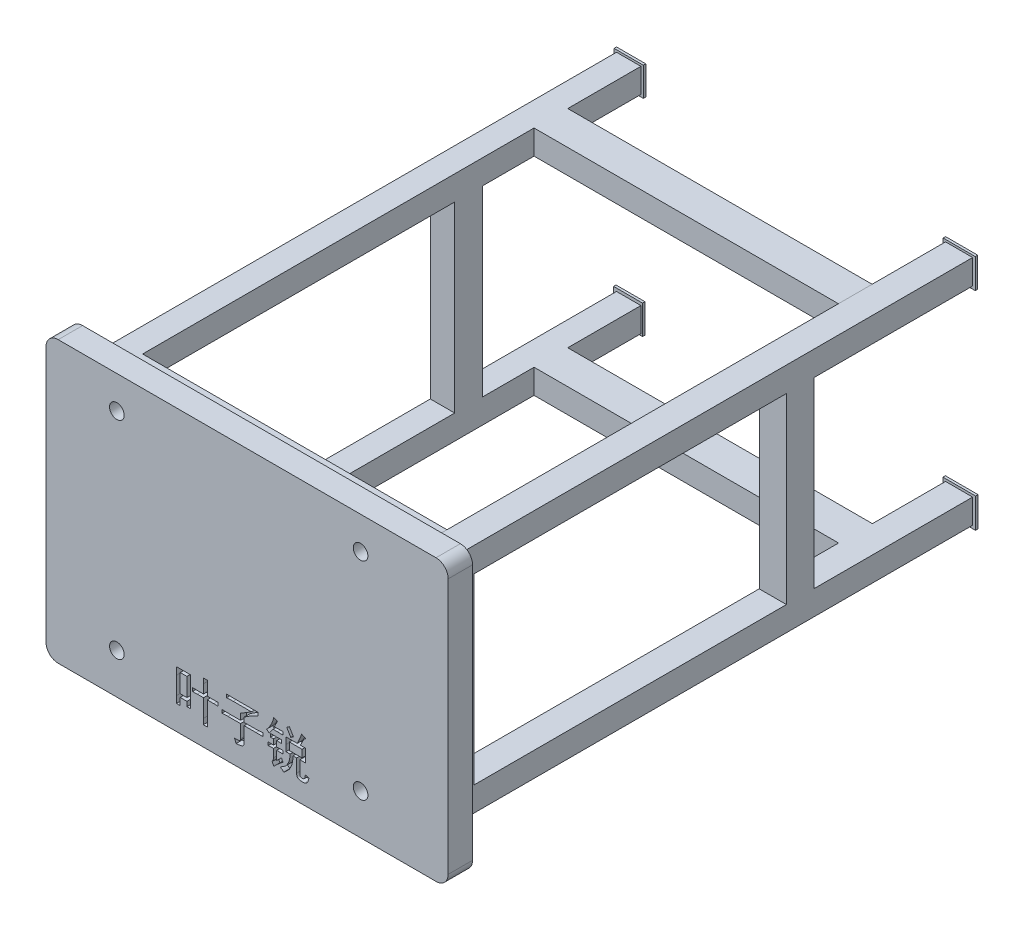
from build123d import *

# Parameters (mm, degrees)
EXTRUDE_1_DEPTH      = 20
SKETCH_3_W           = 250
SKETCH_3_H           = 20
EXTRUDE_2_DEPTH      = 20
SKETCH_4_W           = 250
SKETCH_4_H           = 20
EXTRUDE_3_DEPTH      = 20
SKETCH_2_3_R         = 6
CUT_EXTRUDE_2_DEPTH  = 40
SKETCH_5_W           = 22.217618234
SKETCH_5_H           = 20.249754408
SKETCH_5_H_2         = 20
SKETCH_5_W_2         = 20
EXTRUDE_4_DEPTH      = 430
SKETCH_6_W           = 22.217618234
SKETCH_6_H           = 150
SKETCH_6_W_2         = 20
EXTRUDE_6_DEPTH      = 20
SKETCH_6_5_W         = 22.217618234
SKETCH_6_5_H         = 150
SKETCH_6_5_W_2       = 20
EXTRUDE_13_DEPTH     = 300
SKETCH_10_W          = 256.372974203
SKETCH_10_H          = 150
CUT_EXTRUDE_9_DEPTH  = 400
SKETCH_4_4_W         = 250
SKETCH_4_4_H         = 20
EXTRUDE_14_DEPTH     = 370
SKETCH_3_4_W         = 250
SKETCH_3_4_H         = 20
EXTRUDE_15_DEPTH     = 370
SKETCH_11_W          = 249.850317038
SKETCH_11_H          = 321.198114599
CUT_EXTRUDE_10_DEPTH = 400
SKETCH_2_R           = 6
CUT_EXTRUDE_12_DEPTH = 200
SKETCH_13_W          = 23.789471045
SKETCH_13_H          = 23.789471045
EXTRUDE_17_DEPTH     = 2
SKETCH_14_W          = 26.40849538
SKETCH_14_H          = 24.2259751
EXTRUDE_18_DEPTH     = 2
SKETCH_15_W          = 26.844999436
SKETCH_15_H          = 24.444227128
EXTRUDE_19_DEPTH     = 2
SKETCH_17_W          = 24.007723073
SKETCH_17_H          = 23.571219016
EXTRUDE_21_DEPTH     = 2
SKETCH_20_W          = 5.555555556
SKETCH_20_H          = 15.058479533
SKETCH_20_W_2        = 10.380116959
SKETCH_20_H_2        = 6.140350877
CUT_EXTRUDE_13_DEPTH = 5


with BuildPart() as part:
    # 草图1 → 凸台-拉伸1 (new body)
    with BuildSketch(Plane.XY):
        with BuildLine():
            Line((-38.138232369, 236.708963796), (-38.138232369, 26.708963796))
            ThreePointArc((-38.138232369, 26.708963796), (-35.209300181, 19.637895984), (-28.138232369, 16.708963796))
            Line((-28.138232369, 16.708963796), (281.861767631, 16.708963796))
            ThreePointArc((281.861767631, 16.708963796), (288.932835443, 19.637895984), (291.861767631, 26.708963796))
            Line((291.861767631, 26.708963796), (291.861767631, 236.708963796))
            ThreePointArc((291.861767631, 236.708963796), (288.932835443, 243.780031608), (281.861767631, 246.708963796))
            Line((281.861767631, 246.708963796), (-28.138232369, 246.708963796))
            ThreePointArc((-28.138232369, 246.708963796), (-35.209300181, 243.780031608), (-38.138232369, 236.708963796))
        make_face()
    extrude(amount=EXTRUDE_1_DEPTH)

    # 草图3 → 凸台-拉伸2 (add)
    with BuildSketch(Plane(origin=(0, 0, 0), x_dir=(-1, 0, 0), z_dir=(0, 0, -1))):
        with Locations((-125, 220)):
            Rectangle(SKETCH_3_W, SKETCH_3_H)
    extrude(amount=EXTRUDE_2_DEPTH)

    # 草图4 → 凸台-拉伸3 (add)
    with BuildSketch(Plane(origin=(0, 0, 0), x_dir=(-1, 0, 0), z_dir=(0, 0, -1))):
        with Locations((-125, 50)):
            Rectangle(SKETCH_4_W, SKETCH_4_H)
    extrude(amount=EXTRUDE_3_DEPTH)

    # 草图2<3> → 切除-拉伸2 (cut)
    with BuildSketch(Plane.XY.offset(20)):
        with Locations((20, 220)):
            Circle(SKETCH_2_3_R)
        with Locations((20, 50)):
            Circle(SKETCH_2_3_R)
        with Locations((220, 50)):
            Circle(SKETCH_2_3_R)
        with Locations((220, 220)):
            Circle(SKETCH_2_3_R)
    extrude(amount=-CUT_EXTRUDE_2_DEPTH, mode=Mode.SUBTRACT)

    # 草图5 → 凸台-拉伸4 (add)
    with BuildSketch(Plane(origin=(0, 0, 0), x_dir=(-1, 0, 0), z_dir=(0, 0, -1))):
        with Locations((-261.108809117, 220.124877204)):
            Rectangle(SKETCH_5_W, SKETCH_5_H)
        with Locations((-261.108809117, 50)):
            Rectangle(SKETCH_5_W, SKETCH_5_H_2)
        with Locations((10, 220)):
            Rectangle(SKETCH_5_W_2, SKETCH_5_H_2)
        with Locations((10, 50)):
            Rectangle(SKETCH_5_W_2, SKETCH_5_H_2)
    extrude(amount=EXTRUDE_4_DEPTH)

    # 草图6 → 凸台-拉伸6 (add)
    with BuildSketch(Plane(origin=(0, 0, 0), x_dir=(-1, 0, 0), z_dir=(0, 0, -1))):
        with Locations((-261.108809117, 135)):
            Rectangle(SKETCH_6_W, SKETCH_6_H)
        with Locations((10, 135)):
            Rectangle(SKETCH_6_W_2, SKETCH_6_H)
    extrude(amount=EXTRUDE_6_DEPTH)

    # 草图6<5> → 凸台-拉伸13 (add)
    with BuildSketch(Plane(origin=(0, 0, 0), x_dir=(-1, 0, 0), z_dir=(0, 0, -1))):
        with Locations((-261.108809117, 135)):
            Rectangle(SKETCH_6_5_W, SKETCH_6_5_H)
        with Locations((10, 135)):
            Rectangle(SKETCH_6_5_W_2, SKETCH_6_5_H)
    extrude(amount=EXTRUDE_13_DEPTH)

    # 草图10 → 切除-拉伸9 (cut)
    with BuildSketch(Plane(origin=(272.217618234, 0, 0), x_dir=(0, 0, -1), z_dir=(1, 0, 0))):
        with Locations((149.029257436, 135)):
            Rectangle(SKETCH_10_W, SKETCH_10_H)
    extrude(amount=-CUT_EXTRUDE_9_DEPTH, mode=Mode.SUBTRACT)

    # 草图4<4> → 凸台-拉伸14 (add)
    with BuildSketch(Plane(origin=(0, 0, 0), x_dir=(-1, 0, 0), z_dir=(0, 0, -1))):
        with Locations((-125, 50)):
            Rectangle(SKETCH_4_4_W, SKETCH_4_4_H)
    extrude(amount=EXTRUDE_14_DEPTH)

    # 草图3<4> → 凸台-拉伸15 (add)
    with BuildSketch(Plane(origin=(0, 0, 0), x_dir=(-1, 0, 0), z_dir=(0, 0, -1))):
        with Locations((-125, 220)):
            Rectangle(SKETCH_3_4_W, SKETCH_3_4_H)
    extrude(amount=EXTRUDE_15_DEPTH)

    # 草图11 → 切除-拉伸10 (cut)
    with BuildSketch(Plane(origin=(0, 40, 0), x_dir=(-1, 0, 0), z_dir=(0, -1, 0))):
        with Locations((-124.925158519, 181.740579508)):
            Rectangle(SKETCH_11_W, SKETCH_11_H)
    extrude(amount=-CUT_EXTRUDE_10_DEPTH, mode=Mode.SUBTRACT)

    # 草图2 → 切除-拉伸12 (cut)
    with BuildSketch(Plane.XY.offset(20)):
        with Locations((20, 220)):
            Circle(SKETCH_2_R)
        with Locations((20, 50)):
            Circle(SKETCH_2_R)
        with Locations((220, 50)):
            Circle(SKETCH_2_R)
        with Locations((220, 220)):
            Circle(SKETCH_2_R)
    extrude(amount=-CUT_EXTRUDE_12_DEPTH, mode=Mode.SUBTRACT)

    # 草图13 → 凸台-拉伸17 (add)
    with BuildSketch(Plane(origin=(0, 0, -430), x_dir=(-1, 0, 0), z_dir=(0, 0, -1))):
        with Locations((10.527883953, 50.519209405)):
            Rectangle(SKETCH_13_W, SKETCH_13_H)
    extrude(amount=EXTRUDE_17_DEPTH)

    # 草图14 → 凸台-拉伸18 (add)
    with BuildSketch(Plane(origin=(0, 0, -430), x_dir=(-1, 0, 0), z_dir=(0, 0, -1))):
        with Locations((-261.195890824, 219.882783081)):
            Rectangle(SKETCH_14_W, SKETCH_14_H)
    extrude(amount=EXTRUDE_18_DEPTH)

    # 草图15 → 凸台-拉伸19 (add)
    with BuildSketch(Plane(origin=(0, 0, -430), x_dir=(-1, 0, 0), z_dir=(0, 0, -1))):
        with Locations((-261.195890824, 49.755327307)):
            Rectangle(SKETCH_15_W, SKETCH_15_H)
    extrude(amount=EXTRUDE_19_DEPTH)

    # 草图17 → 凸台-拉伸21 (add)
    with BuildSketch(Plane(origin=(0, 0, -430), x_dir=(-1, 0, 0), z_dir=(0, 0, -1))):
        with Locations((9.982253884, 219.991909095)):
            Rectangle(SKETCH_17_W, SKETCH_17_H)
    extrude(amount=EXTRUDE_21_DEPTH)

    # 草图20 → 切除-拉伸13 (cut)
    # profile 1 of 7: a face of its own
    with BuildSketch(Plane.XY.offset(20)):
        with BuildLine():
            add(Edge.make_bspline(
                [(80.585150008, 62.833981145), (80.543192801, 61.823365888), (80.460275153, 59.82614427), (80.446001976, 57.827257852), (80.438951177, 56.839829098)],
                knots=[0, 0, 0, 0, 1.012021148, 2, 2, 2, 2], degree=3))
            Line((80.438951177, 56.839829098), (80.438951177, 44.412928513))
            add(Edge.make_bspline(
                [(80.438951177, 44.412928513), (80.44130177, 43.911144546), (80.445927192, 42.923750114), (80.474265108, 41.470718415), (80.514010208, 40.071545237), (80.561745727, 39.158722588), (80.585150008, 38.711174127)],
                knots=[0, 0, 0, 0, 1.055588755, 2.077153766, 3.057246363, 4, 4, 4, 4], degree=3))
            Line((80.585150008, 38.711174127), (77.514974569, 38.711174127))
            Line((77.514974569, 38.711174127), (77.514974569, 42.512343718))
            Line((77.514974569, 42.512343718), (71.959419013, 42.512343718))
            Line((71.959419013, 42.512343718), (71.959419013, 36.664390502))
            Line((71.959419013, 36.664390502), (68.889243575, 36.664390502))
            add(Edge.make_bspline(
                [(68.889243575, 36.664390502), (68.931200297, 37.626265585), (69.014065324, 39.525980394), (69.028377069, 41.427442544), (69.035442405, 42.366144888)],
                knots=[0, 0, 0, 0, 1.012652087, 2, 2, 2, 2], degree=3))
            Line((69.035442405, 42.366144888), (69.035442405, 56.839829098))
            add(Edge.make_bspline(
                [(69.035442405, 56.839829098), (69.036300893, 57.02032948), (69.038112458, 57.401217807), (69.022872119, 58.002177545), (69.014684889, 58.662849736), (68.997909823, 59.3830264), (68.974158069, 60.160839191), (68.956394084, 60.998553174), (68.919691525, 61.895352555), (68.899607329, 62.514494427), (68.889243575, 62.833981145)],
                knots=[0, 0, 0, 0, 0.722422131, 1.524440851, 2.405914273, 3.366980104, 4.40766924, 5.520574543, 6.720578373, 8, 8, 8, 8], degree=3))
            Line((68.889243575, 62.833981145), (80.585150008, 62.833981145))
        make_face()
        with Locations((74.737196791, 52.673162432)):
            Rectangle(SKETCH_20_W, SKETCH_20_H, mode=Mode.SUBTRACT)
    # profile 2 of 7: a face of its own
    with BuildSketch(Plane.XY.offset(20)):
        with BuildLine():
            Line((91.111465797, 54.500647812), (91.111465797, 61.810589332))
            add(Edge.make_bspline(
                [(91.111465797, 61.810589332), (91.11256123, 62.045238451), (91.114667972, 62.496516838), (91.100238096, 63.144428858), (91.091408531, 63.738314949), (91.076270482, 64.276300025), (91.051652908, 64.761606629), (91.035301073, 65.191792836), (91.000038538, 65.566870533), (90.976243253, 65.797686035), (90.965266967, 65.904156584)],
                knots=[0, 0, 0, 0, 1.374144617, 2.642761962, 3.795123306, 4.852633186, 5.794343395, 6.641027226, 7.373133195, 8, 8, 8, 8], degree=3))
            Line((90.965266967, 65.904156584), (94.474038896, 65.904156584))
            add(Edge.make_bspline(
                [(94.474038896, 65.904156584), (94.449268543, 65.797925973), (94.395850826, 65.568837733), (94.338913544, 65.192328301), (94.291148911, 64.762384842), (94.254702018, 64.276405942), (94.223432691, 63.73844408), (94.193002302, 63.144745135), (94.186604048, 62.496464473), (94.183338981, 62.04522273), (94.181641236, 61.810589332)],
                knots=[0, 0, 0, 0, 0.636468155, 1.372555132, 2.220663323, 3.161164639, 4.216548803, 5.366059947, 6.63042302, 8, 8, 8, 8], degree=3))
            Line((94.181641236, 61.810589332), (94.181641236, 54.500647812))
            Line((94.181641236, 54.500647812), (99.44479913, 54.500647812))
            add(Edge.make_bspline(
                [(99.44479913, 54.500647812), (99.665009697, 54.49952943), (100.0856083, 54.497393339), (100.684785068, 54.511790437), (101.220922834, 54.520453246), (101.692163115, 54.535526708), (102.098028795, 54.559785709), (102.43997446, 54.576179987), (102.717689963, 54.610366646), (102.881427118, 54.63568928), (102.95357106, 54.646846642)],
                knots=[0, 0, 0, 0, 1.503568052, 2.871790535, 4.092147988, 5.165001825, 6.090640109, 6.868636212, 7.50151177, 8, 8, 8, 8], degree=3))
            Line((102.95357106, 54.646846642), (102.95357106, 51.722870034))
            add(Edge.make_bspline(
                [(102.95357106, 51.722870034), (102.872387599, 51.733952337), (102.692266796, 51.758540515), (102.398343763, 51.7924667), (102.052911396, 51.809859979), (101.657860381, 51.833915113), (101.21190129, 51.849050667), (100.715467366, 51.857890726), (100.170445706, 51.872286544), (99.789550361, 51.870171428), (99.590997961, 51.869068864)],
                knots=[0, 0, 0, 0, 0.583846774, 1.295374051, 2.107220792, 3.047450011, 4.115573545, 5.286167145, 6.585338371, 8, 8, 8, 8], degree=3))
            Line((99.590997961, 51.869068864), (94.181641236, 51.869068864))
            Line((94.181641236, 51.869068864), (94.181641236, 37.395384654))
            add(Edge.make_bspline(
                [(94.181641236, 37.395384654), (94.18054857, 37.13546742), (94.178439004, 36.633655823), (94.193130099, 35.90452128), (94.20163091, 35.225805557), (94.217162083, 34.597607665), (94.241683539, 34.02021085), (94.25828067, 33.492698371), (94.294029828, 33.014725659), (94.316980144, 32.713405671), (94.327840066, 32.57082325)],
                knots=[0, 0, 0, 0, 1.291974514, 2.49436248, 3.624982585, 4.666087828, 5.617801518, 6.497794058, 7.289167102, 8, 8, 8, 8], degree=3))
            Line((94.327840066, 32.57082325), (90.965266967, 32.57082325))
            add(Edge.make_bspline(
                [(90.965266967, 32.57082325), (90.976133112, 32.711600314), (90.999112195, 33.009307315), (91.034660883, 33.480066291), (91.051490436, 33.99854912), (91.075737838, 34.561512838), (91.091402356, 35.168045904), (91.100059563, 35.81968901), (91.114641828, 36.518138934), (91.112547959, 37.0000979), (91.111465797, 37.249185823)],
                knots=[0, 0, 0, 0, 0.723794872, 1.530638549, 2.419609744, 3.382538411, 4.419144022, 5.529548865, 6.72321175, 8, 8, 8, 8], degree=3))
            Line((91.111465797, 37.249185823), (91.111465797, 51.869068864))
            Line((91.111465797, 51.869068864), (85.994506733, 51.869068864))
            add(Edge.make_bspline(
                [(85.994506733, 51.869068864), (85.75985708, 51.870198822), (85.312187151, 51.872354582), (84.669693859, 51.857737078), (84.088432285, 51.849284491), (83.564890552, 51.833750506), (83.1012386, 51.809555408), (82.696257174, 51.793247163), (82.351877417, 51.757958394), (82.142773364, 51.733881674), (82.047138312, 51.722870034)],
                knots=[0, 0, 0, 0, 1.424841977, 2.718345834, 3.902263659, 4.954968297, 5.89857508, 6.721767569, 7.415392363, 8, 8, 8, 8], degree=3))
            Line((82.047138312, 51.722870034), (82.047138312, 54.646846642))
            add(Edge.make_bspline(
                [(82.047138312, 54.646846642), (82.140963143, 54.635782275), (82.348222112, 54.611341097), (82.685476897, 54.577238946), (83.079560377, 54.559911843), (83.526984274, 54.53598072), (84.030673294, 54.520543725), (84.588471744, 54.511934175), (85.200279778, 54.497415575), (85.626292498, 54.499540442), (85.848307902, 54.500647812)],
                knots=[0, 0, 0, 0, 0.5957411, 1.315991556, 2.136690648, 3.082414022, 4.141402104, 5.313871089, 6.600131011, 8, 8, 8, 8], degree=3))
            Line((85.848307902, 54.500647812), (91.111465797, 54.500647812))
        make_face()
    # profile 3 of 7: a face of its own
    with BuildSketch(Plane.XY.offset(20)):
        with BuildLine():
            add(Edge.make_bspline(
                [(116.403863458, 35.93339635), (116.67097519, 35.924025185), (117.179854, 35.90617203), (117.903653304, 35.886152989), (118.550130268, 35.891862675), (119.118845981, 35.913891355), (119.610252371, 35.944062716), (120.025611387, 35.988053939), (120.361521393, 36.059727737), (120.63425051, 36.136991742), (120.85378389, 36.250968146), (121.031729486, 36.400398148), (121.190660078, 36.577831409), (121.312037744, 36.794946861), (121.403561501, 37.046107286), (121.475406982, 37.326852816), (121.509311517, 37.643671447), (121.51686933, 37.864613788), (121.520822522, 37.980179975)],
                knots=[0, 0, 0, 0, 1.99776388, 3.805971745, 5.411422682, 6.828974515, 8.059294543, 9.09175245, 9.946365112, 10.624801538, 11.204117109, 11.779334068, 12.352966842, 12.975442788, 13.624400533, 14.347507517, 15.135646642, 16, 16, 16, 16], degree=3))
            Line((121.520822522, 37.980179975), (121.520822522, 48.652694595))
            Line((121.520822522, 48.652694595), (111.140705563, 48.652694595))
            add(Edge.make_bspline(
                [(111.140705563, 48.652694595), (110.785120121, 48.65008951), (110.041374272, 48.644640689), (108.880760889, 48.615551623), (107.62790608, 48.574175989), (106.763703809, 48.52958756), (106.31614416, 48.506495765)],
                knots=[0, 0, 0, 0, 0.883952134, 1.848882584, 2.88596294, 4, 4, 4, 4], degree=3))
            Line((106.31614416, 48.506495765), (106.31614416, 51.138074712))
            add(Edge.make_bspline(
                [(106.31614416, 51.138074712), (106.763703809, 51.114982917), (107.62790608, 51.070394489), (108.880760889, 51.029018855), (110.041374272, 50.999929788), (110.785120121, 50.994480967), (111.140705563, 50.991875882)],
                knots=[0, 0, 0, 0, 1.11403706, 2.151117416, 3.116047866, 4, 4, 4, 4], degree=3))
            Line((111.140705563, 50.991875882), (121.520822522, 50.991875882))
            add(Edge.make_bspline(
                [(121.520822522, 50.991875882), (121.518288773, 51.394388879), (121.513073075, 52.222958214), (121.48388244, 53.502693893), (121.442946779, 54.854829023), (121.397783523, 55.780399114), (121.374623692, 56.255033777)],
                knots=[0, 0, 0, 0, 0.91729495, 1.888243292, 2.917085867, 4, 4, 4, 4], degree=3))
            add(Edge.make_bspline(
                [(121.374623692, 56.255033777), (121.718894991, 56.407387642), (122.416040568, 56.715902535), (123.452444498, 57.239371138), (124.495399658, 57.820362732), (125.561921148, 58.456290658), (126.667915467, 59.152827321), (127.854082951, 59.889414419), (129.118319097, 60.68521593), (129.989569805, 61.234748776), (130.438951177, 61.518191671)],
                knots=[0, 0, 0, 0, 0.860984, 1.743483089, 2.654499045, 3.591184784, 4.583221198, 5.643959329, 6.784780571, 8, 8, 8, 8], degree=3))
            Line((130.438951177, 61.518191671), (115.526670475, 61.518191671))
            add(Edge.make_bspline(
                [(115.526670475, 61.518191671), (115.03029914, 61.515926738), (114.068166117, 61.511536544), (112.669282534, 61.483107316), (111.36206584, 61.444372115), (110.521532845, 61.395497188), (110.11731375, 61.371992841)],
                knots=[0, 0, 0, 0, 1.100569348, 2.133270069, 3.102274524, 4, 4, 4, 4], degree=3))
            Line((110.11731375, 61.371992841), (110.11731375, 64.003571788))
            add(Edge.make_bspline(
                [(110.11731375, 64.003571788), (110.60819921, 63.98053994), (111.546454354, 63.93651796), (112.889519722, 63.895065215), (114.104264503, 63.865590915), (114.871468579, 63.860011443), (115.234272815, 63.857372958)],
                knots=[0, 0, 0, 0, 1.151882776, 2.201654005, 3.149577585, 4, 4, 4, 4], degree=3))
            Line((115.234272815, 63.857372958), (135.848307902, 63.857372958))
            Line((135.848307902, 63.857372958), (135.848307902, 61.22579401))
            add(Edge.make_bspline(
                [(135.848307902, 61.22579401), (135.471677816, 61.069730018), (134.695898521, 60.748270796), (133.518051034, 60.195758286), (132.286229887, 59.572020617), (131.220631679, 59.002238236), (130.331285316, 58.49339212), (129.607813664, 58.078373303), (128.849109855, 57.616607826), (128.045344296, 57.12582402), (127.206913539, 56.589832212), (126.316723242, 56.032080139), (125.394622314, 55.423215015), (124.765992282, 55.006144231), (124.44479913, 54.793045472)],
                knots=[0, 0, 0, 0, 1.118912614, 2.304726232, 3.569843526, 4.90866209, 5.620867445, 6.382242391, 7.19790347, 8.058644711, 8.967163679, 9.929256126, 10.941971086, 12, 12, 12, 12], degree=3))
            Line((124.44479913, 54.793045472), (124.44479913, 50.991875882))
            Line((124.44479913, 50.991875882), (134.240120768, 50.991875882))
            add(Edge.make_bspline(
                [(134.240120768, 50.991875882), (134.666168851, 50.994132191), (135.543939229, 50.998780776), (136.895650172, 51.067961873), (138.322646238, 51.147144722), (139.295948289, 51.23775235), (139.795676323, 51.284273543)],
                knots=[0, 0, 0, 0, 0.918554275, 1.892461824, 2.91791463, 4, 4, 4, 4], degree=3))
            Line((139.795676323, 51.284273543), (139.795676323, 48.652694595))
            add(Edge.make_bspline(
                [(139.795676323, 48.652694595), (139.29577907, 48.672694774), (138.321504262, 48.711674125), (136.895183664, 48.736173729), (135.542680672, 48.71453293), (134.66600162, 48.672913061), (134.240120768, 48.652694595)],
                knots=[0, 0, 0, 0, 1.080146899, 2.105152423, 3.079504296, 4, 4, 4, 4], degree=3))
            Line((134.240120768, 48.652694595), (124.44479913, 48.652694595))
            Line((124.44479913, 48.652694595), (124.44479913, 36.956788163))
            add(Edge.make_bspline(
                [(124.44479913, 36.956788163), (124.43937059, 36.725603136), (124.429032581, 36.285338787), (124.358472144, 35.659695212), (124.221847425, 35.107717272), (124.040735909, 34.626813258), (123.806880689, 34.213834603), (123.51100185, 33.879427163), (123.161249749, 33.61624927), (122.754544016, 33.434969223), (122.300884838, 33.301744466), (121.804405738, 33.161656714), (121.249564546, 33.047761422), (120.644843593, 32.934121823), (119.988087963, 32.824691139), (119.278353038, 32.728455218), (118.51647693, 32.641841081), (117.990502882, 32.594963055), (117.719652932, 32.57082325)],
                knots=[0, 0, 0, 0, 1.19465871, 2.275085226, 3.245453989, 4.125282031, 4.923472634, 5.683254117, 6.416292555, 7.167323422, 7.969589919, 8.858710878, 9.831854302, 10.89458634, 12.038362794, 13.271568753, 14.594996333, 16, 16, 16, 16], degree=3))
            add(Edge.make_bspline(
                [(117.719652932, 32.57082325), (117.662467644, 32.843201301), (117.544816683, 33.40358214), (117.246329272, 34.235139171), (116.876001392, 35.090734355), (116.564231084, 35.647175535), (116.403863458, 35.93339635)],
                knots=[0, 0, 0, 0, 0.919528502, 1.891804984, 2.915591952, 4, 4, 4, 4], degree=3))
        make_face()
    # profile 4 of 7: a face of its own
    with BuildSketch(Plane.XY.offset(20)):
        with BuildLine():
            add(Edge.make_bspline(
                [(171.520822522, 66.342753075), (171.775607556, 66.197325162), (172.301066407, 65.897400231), (173.145105767, 65.488843451), (174.058147243, 65.091955071), (174.699821495, 64.855887273), (175.029594452, 64.73456594)],
                knots=[0, 0, 0, 0, 0.910522563, 1.8778267, 2.909360376, 4, 4, 4, 4], degree=3))
            add(Edge.make_bspline(
                [(175.029594452, 64.73456594), (174.794942202, 64.579129295), (174.323607838, 64.266911396), (173.709595163, 63.665949429), (173.178932342, 62.965682777), (172.738272601, 62.150230551), (172.312482204, 61.231761781), (171.808211156, 60.217488916), (171.254143974, 59.076848996), (170.854024759, 58.281460894), (170.64362954, 57.863220911)],
                knots=[0, 0, 0, 0, 0.815184786, 1.637421345, 2.478505109, 3.355460144, 4.320502962, 5.416640458, 6.641588617, 8, 8, 8, 8], degree=3))
            Line((170.64362954, 57.863220911), (174.883395622, 57.863220911))
            add(Edge.make_bspline(
                [(174.883395622, 57.863220911), (174.872459762, 57.717033789), (174.848976189, 57.403112789), (174.813575694, 56.898011618), (174.796946584, 56.325403567), (174.772563038, 55.684812628), (174.757144671, 54.975396212), (174.74851912, 54.195614809), (174.734003418, 53.347344761), (174.736106557, 52.758903239), (174.737196791, 52.453864186)],
                knots=[0, 0, 0, 0, 0.650022705, 1.395853302, 2.244779911, 3.1896817, 4.238355534, 5.390905231, 6.647485315, 8, 8, 8, 8], degree=3))
            add(Edge.make_bspline(
                [(174.737196791, 52.453864186), (174.736103084, 52.161459277), (174.733996594, 51.598285018), (174.748481242, 50.78791979), (174.757178899, 50.044235688), (174.772513027, 49.369105757), (174.796774148, 48.76281313), (174.813472469, 48.226269987), (174.84873338, 47.759078283), (174.87243064, 47.470454501), (174.883395622, 47.336905122)],
                knots=[0, 0, 0, 0, 1.370459824, 2.639516896, 3.798609498, 4.856367569, 5.804450032, 6.642636586, 7.371933111, 8, 8, 8, 8], degree=3))
            Line((174.883395622, 47.336905122), (170.205033049, 47.336905122))
            Line((170.205033049, 47.336905122), (170.205033049, 37.102986993))
            add(Edge.make_bspline(
                [(170.205033049, 37.102986993), (170.198790317, 36.94410278), (170.187039677, 36.64503643), (170.236928903, 36.224551614), (170.354030372, 35.867929797), (170.539413416, 35.58001119), (170.784130043, 35.352832639), (171.100521704, 35.207818901), (171.473102109, 35.128133702), (171.886319564, 35.118434829), (172.303121675, 35.156493121), (172.693269611, 35.199043548), (173.038690135, 35.273905038), (173.336600091, 35.37833083), (173.594130014, 35.494076685), (173.806879704, 35.634991942), (173.967922619, 35.806968438), (174.08603393, 36.008452425), (174.175309799, 36.242717655), (174.262786608, 36.517802037), (174.346410867, 36.840166347), (174.434786217, 37.209538394), (174.514908771, 37.627016863), (174.588335895, 38.091657356), (174.665605776, 38.604088292), (174.71255821, 38.96196998), (174.737196791, 39.149770619)],
                knots=[0, 0, 0, 0, 1.307457259, 2.461015249, 3.466439899, 4.368904078, 5.252335654, 6.175951847, 7.195978638, 8.370488853, 9.562347653, 10.640340744, 11.599132503, 12.463623085, 13.234588625, 13.918633699, 14.549292097, 15.155685249, 15.828834341, 16.608765724, 17.53130593, 18.569137077, 19.734592147, 21.029070789, 22.440986446, 24, 24, 24, 24], degree=3))
            add(Edge.make_bspline(
                [(174.737196791, 39.149770619), (175.220351538, 38.920917252), (176.170906303, 38.47067298), (177.169937095, 38.14186104), (177.661173399, 37.980179975)],
                knots=[0, 0, 0, 0, 1.016574247, 2, 2, 2, 2], degree=3))
            add(Edge.make_bspline(
                [(177.661173399, 37.980179975), (177.587362934, 37.678251454), (177.447080099, 37.104411568), (177.215539962, 36.29166653), (176.9686413, 35.573794552), (176.711905425, 34.94777558), (176.439176957, 34.417781131), (176.163701514, 33.973101685), (175.864148037, 33.62765867), (175.550110293, 33.363291613), (175.19990487, 33.178708141), (174.824656633, 33.014738517), (174.401631679, 32.888763979), (173.939953074, 32.776852117), (173.432072708, 32.705510078), (172.880759841, 32.658422332), (172.288210812, 32.629002178), (171.668469913, 32.638005861), (171.055422781, 32.665366213), (170.482422095, 32.731026541), (169.963815049, 32.819842395), (169.503549432, 32.943688164), (169.099586152, 33.09355924), (168.751841043, 33.272441916), (168.459173541, 33.484410038), (168.149034418, 33.812081338), (167.860618313, 34.298825563), (167.641036869, 34.961613575), (167.528911914, 35.713545318), (167.558054612, 36.240002754), (167.573454101, 36.518191671)],
                knots=[0, 0, 0, 0, 1.653299447, 3.142231029, 4.493384325, 5.689818876, 6.737562072, 7.661706637, 8.464640946, 9.160433153, 9.83092512, 10.562116729, 11.336473057, 12.174845753, 13.087295943, 14.060840877, 15.118043119, 16.241403041, 17.356609736, 18.380818134, 19.307403247, 20.152838007, 20.91247196, 21.595292559, 22.227065688, 22.824647003, 23.983867828, 25.201381166, 26.521162986, 28, 28, 28, 28], degree=3))
            Line((167.573454101, 36.518191671), (167.573454101, 47.336905122))
            Line((167.573454101, 47.336905122), (164.649477493, 47.336905122))
            add(Edge.make_bspline(
                [(164.649477493, 47.336905122), (164.623538143, 46.921534393), (164.573059434, 46.113211204), (164.450532057, 44.936323445), (164.308697466, 43.82662195), (164.128537538, 42.786736465), (163.925653127, 41.813700605), (163.686694697, 40.910795993), (163.425594762, 40.073412317), (163.122459835, 39.307176327), (162.806744648, 38.597852766), (162.48819358, 37.933536162), (162.157827477, 37.319392326), (161.825821186, 36.745701625), (161.490432813, 36.215399576), (161.133588575, 35.740447674), (160.783927338, 35.301269234), (160.289187722, 34.777767346), (159.628271342, 34.151012741), (158.789235733, 33.389875022), (157.872100143, 32.617434372), (157.230562617, 32.103757302), (156.900939481, 31.839829098)],
                knots=[0, 0, 0, 0, 1.381709165, 2.688845122, 3.928009352, 5.09552725, 6.192171191, 7.227148238, 8.195653838, 9.102670197, 9.961252781, 10.773402238, 11.548255853, 12.275998132, 12.974195836, 13.62984185, 14.247580766, 14.836995633, 16.019490942, 17.271213883, 18.597944781, 20, 20, 20, 20], degree=3))
            add(Edge.make_bspline(
                [(156.900939481, 31.839829098), (156.736460889, 32.03974581), (156.384807077, 32.467166016), (155.709039214, 33.041133834), (154.904776617, 33.632255756), (154.298309625, 33.989642826), (153.976962873, 34.179010385)],
                knots=[0, 0, 0, 0, 0.82307135, 1.759719455, 2.812949617, 4, 4, 4, 4], degree=3))
            add(Edge.make_bspline(
                [(153.976962873, 34.179010385), (154.318135673, 34.346946969), (154.977735064, 34.671623697), (155.906484077, 35.201166491), (156.752731731, 35.734395785), (157.511924268, 36.278955325), (158.180649601, 36.835149451), (158.773026247, 37.389040667), (159.266845768, 37.966648942), (159.804596406, 38.728448036), (160.337299515, 39.678658405), (160.889917871, 40.776489482), (161.306685319, 41.834284719), (161.59316151, 42.869308087), (161.788249183, 43.913244635), (161.958998001, 44.996071238), (162.081156259, 46.14573377), (162.135932353, 46.932408904), (162.164097376, 47.336905122)],
                knots=[0, 0, 0, 0, 1.104887515, 2.136111476, 3.105261302, 4.010772165, 4.848936483, 5.631766743, 6.36456559, 7.052992536, 8.338628186, 9.52563003, 10.623422528, 11.636476683, 12.641527875, 13.70831806, 14.8216525, 16, 16, 16, 16], degree=3))
            Line((162.164097376, 47.336905122), (158.801524277, 47.336905122))
            add(Edge.make_bspline(
                [(158.801524277, 47.336905122), (158.825120149, 47.703208785), (158.875303851, 48.482263399), (158.913411493, 49.726415774), (158.94132405, 51.11448014), (158.945522815, 52.089250878), (158.947723107, 52.600063016)],
                knots=[0, 0, 0, 0, 0.836376204, 1.778804873, 2.836020215, 4, 4, 4, 4], degree=3))
            add(Edge.make_bspline(
                [(158.947723107, 52.600063016), (158.948785769, 52.87261399), (158.950854891, 53.403301393), (158.936271564, 54.175758393), (158.927608398, 54.903200843), (158.912006331, 55.583727928), (158.887650398, 56.21890485), (158.870807117, 56.807719813), (158.834852933, 57.350686294), (158.81232212, 57.697169549), (158.801524277, 57.863220911)],
                knots=[0, 0, 0, 0, 1.24205513, 2.418421051, 3.520764922, 4.557475512, 5.520424865, 6.417611212, 7.241643544, 8, 8, 8, 8], degree=3))
            Line((158.801524277, 57.863220911), (168.012050592, 57.863220911))
            add(Edge.make_bspline(
                [(168.012050592, 57.863220911), (168.255281411, 58.364334869), (168.72029771, 59.322380234), (169.36348878, 60.702044372), (169.928917164, 61.953799512), (170.412481556, 63.077117822), (170.80895508, 64.074204141), (171.125501275, 64.94186302), (171.365602539, 65.681056253), (171.472817399, 66.138109081), (171.520822522, 66.342753075)],
                knots=[0, 0, 0, 0, 1.454223274, 2.780229613, 3.973973343, 5.040060598, 5.972845103, 6.774801336, 7.451421078, 8, 8, 8, 8], degree=3))
        make_face()
        with Locations((166.769360533, 52.600063017)):
            Rectangle(SKETCH_20_W_2, SKETCH_20_H_2, mode=Mode.SUBTRACT)
    # profile 5 of 7: a face of its own
    with BuildSketch(Plane.XY.offset(20)):
        with BuildLine():
            add(Edge.make_bspline(
                [(156.31614416, 38.564975297), (156.058510911, 38.380856123), (155.51298942, 37.990995859), (154.677303465, 37.335360521), (153.758898728, 36.601329079), (152.790266079, 35.776686985), (151.786422621, 34.896342244), (150.791202407, 33.963024128), (149.80911303, 32.996687065), (149.177278187, 32.323877611), (148.860003809, 31.986027929)],
                knots=[0, 0, 0, 0, 0.762969492, 1.615537815, 2.559021453, 3.595951093, 4.680618272, 5.77609673, 6.88327221, 8, 8, 8, 8], degree=3))
            add(Edge.make_bspline(
                [(148.860003809, 31.986027929), (148.622192986, 32.453153782), (148.166616167, 33.348031937), (147.646588869, 34.207013275), (147.398015505, 34.617606876)],
                knots=[0, 0, 0, 0, 1.043998785, 2, 2, 2, 2], degree=3))
            add(Edge.make_bspline(
                [(147.398015505, 34.617606876), (147.555858139, 34.88507672), (147.867170408, 35.412606211), (148.220347258, 36.249849437), (148.45834503, 37.108237115), (148.531260065, 37.690125215), (148.567606148, 37.980179975)],
                knots=[0, 0, 0, 0, 1.036206171, 2.043704462, 3.024842003, 4, 4, 4, 4], degree=3))
            Line((148.567606148, 37.980179975), (148.567606148, 44.559127344))
            add(Edge.make_bspline(
                [(148.567606148, 44.559127344), (148.239092686, 44.556550592), (147.556701763, 44.55119814), (146.497156715, 44.522114), (145.363394249, 44.480791344), (144.584070135, 44.436038219), (144.181641236, 44.412928513)],
                knots=[0, 0, 0, 0, 0.898209309, 1.865767918, 2.897921095, 4, 4, 4, 4], degree=3))
            Line((144.181641236, 44.412928513), (144.181641236, 47.044507461))
            add(Edge.make_bspline(
                [(144.181641236, 47.044507461), (144.602125219, 47.021463713), (145.406762027, 46.977367271), (146.558544825, 46.936055815), (147.600019966, 46.906537538), (148.257142258, 46.900948993), (148.567606148, 46.89830863)],
                knots=[0, 0, 0, 0, 1.151380773, 2.203278568, 3.151121288, 4, 4, 4, 4], degree=3))
            Line((148.567606148, 46.89830863), (148.567606148, 51.430472373))
            add(Edge.make_bspline(
                [(148.567606148, 51.430472373), (148.42499293, 51.427548347), (148.096281634, 51.420808717), (147.538581334, 51.390793742), (146.852417491, 51.349179692), (146.352882415, 51.307082499), (146.082226031, 51.284273543)],
                knots=[0, 0, 0, 0, 0.687359596, 1.584305203, 2.691136515, 4, 4, 4, 4], degree=3))
            Line((146.082226031, 51.284273543), (146.082226031, 54.06205132))
            add(Edge.make_bspline(
                [(146.082226031, 54.06205132), (146.466598302, 54.038845448), (147.222402117, 53.993214978), (148.338167424, 53.95238714), (149.41577112, 53.923426821), (150.121627336, 53.91834673), (150.468190943, 53.91585249)],
                knots=[0, 0, 0, 0, 1.052783815, 2.070123375, 3.052462826, 4, 4, 4, 4], degree=3))
            add(Edge.make_bspline(
                [(150.468190943, 53.91585249), (150.843631804, 53.918354001), (151.610844415, 53.923465835), (152.789510613, 53.952658338), (154.022554799, 53.993492315), (154.863247989, 54.038868791), (155.292752347, 54.06205132)],
                knots=[0, 0, 0, 0, 0.933291385, 1.907178983, 2.930792163, 4, 4, 4, 4], degree=3))
            Line((155.292752347, 54.06205132), (155.292752347, 51.284273543))
            add(Edge.make_bspline(
                [(155.292752347, 51.284273543), (154.610700566, 51.32623774), (153.247432922, 51.410114705), (151.881655219, 51.423689258), (151.199185095, 51.430472373)],
                knots=[0, 0, 0, 0, 1.000613171, 2, 2, 2, 2], degree=3))
            Line((151.199185095, 51.430472373), (151.199185095, 46.89830863))
            add(Edge.make_bspline(
                [(151.199185095, 46.89830863), (151.576429634, 46.900866132), (152.356271412, 46.906153011), (153.562011354, 46.93519365), (154.841950838, 46.976418761), (155.718776873, 47.021375231), (156.169945329, 47.044507461)],
                knots=[0, 0, 0, 0, 0.91023221, 1.88163653, 2.910001827, 4, 4, 4, 4], degree=3))
            Line((156.169945329, 47.044507461), (156.169945329, 44.412928513))
            add(Edge.make_bspline(
                [(156.169945329, 44.412928513), (155.718776873, 44.436060743), (154.841950838, 44.481017213), (153.562011354, 44.522242324), (152.356271412, 44.551282964), (151.576429634, 44.556569843), (151.199185095, 44.559127344)],
                knots=[0, 0, 0, 0, 1.089998173, 2.11836347, 3.08976779, 4, 4, 4, 4], degree=3))
            Line((151.199185095, 44.559127344), (151.199185095, 37.395384654))
            add(Edge.make_bspline(
                [(151.199185095, 37.395384654), (151.317115061, 37.490303869), (151.569570561, 37.693499703), (151.961723884, 38.036363841), (152.387436037, 38.446989208), (152.862010355, 38.909163722), (153.3794964, 39.429837127), (153.927382993, 40.017049141), (154.527354929, 40.655607651), (154.934415336, 41.107336227), (155.146553516, 41.342753075)],
                knots=[0, 0, 0, 0, 0.650137028, 1.391763888, 2.236178795, 3.189999306, 4.236954369, 5.388510752, 6.639031048, 8, 8, 8, 8], degree=3))
            add(Edge.make_bspline(
                [(155.146553516, 41.342753075), (155.204066669, 41.119576075), (155.322610651, 40.6595719), (155.581814849, 39.971510755), (155.912795808, 39.266148174), (156.179113651, 38.803186451), (156.31614416, 38.564975297)],
                knots=[0, 0, 0, 0, 0.91342565, 1.882719161, 2.910579675, 4, 4, 4, 4], degree=3))
        make_face()
    # profile 6 of 7: a face of its own
    with BuildSketch(Plane.XY.offset(20)):
        with BuildLine():
            add(Edge.make_bspline(
                [(142.865851762, 55.377840794), (142.992278613, 55.495101231), (143.258362673, 55.741893212), (143.638181942, 56.169877411), (144.04163441, 56.650491035), (144.449833953, 57.200285405), (144.87747701, 57.807052871), (145.323014571, 58.473114777), (145.775068213, 59.204462805), (146.391122587, 60.24733458), (147.107555731, 61.587320479), (147.809566452, 63.2255393), (148.369557156, 64.850030389), (148.600218645, 65.948181352), (148.713804978, 66.488951905)],
                knots=[0, 0, 0, 0, 0.487771791, 1.026588075, 1.617869835, 2.263581037, 2.963739435, 3.718912056, 4.531158516, 5.396768836, 7.147185333, 8.82680745, 10.437401461, 12, 12, 12, 12], degree=3))
            add(Edge.make_bspline(
                [(148.713804978, 66.488951905), (149.211483522, 66.299807159), (150.220713695, 65.916245145), (151.25813796, 65.617158877), (151.783980417, 65.465560092)],
                knots=[0, 0, 0, 0, 0.986253794, 2, 2, 2, 2], degree=3))
            add(Edge.make_bspline(
                [(151.783980417, 65.465560092), (151.56331284, 65.085999921), (151.108046202, 64.302916672), (150.450445873, 63.069637082), (149.793360635, 61.743302845), (149.370239647, 60.822608294), (149.15240147, 60.348601028)],
                knots=[0, 0, 0, 0, 0.915106287, 1.887986302, 2.912658017, 4, 4, 4, 4], degree=3))
            Line((149.15240147, 60.348601028), (152.368775739, 60.348601028))
            add(Edge.make_bspline(
                [(152.368775739, 60.348601028), (153.002528889, 60.355386477), (154.270936971, 60.36896703), (155.53664259, 60.452835707), (156.169945329, 60.494799858)],
                knots=[0, 0, 0, 0, 0.999289044, 2, 2, 2, 2], degree=3))
            Line((156.169945329, 60.494799858), (156.169945329, 57.863220911))
            add(Edge.make_bspline(
                [(156.169945329, 57.863220911), (155.439146652, 57.905185145), (153.978329737, 57.9890688), (152.515169627, 58.002638511), (151.783980417, 58.009419741)],
                knots=[0, 0, 0, 0, 1.000534248, 2, 2, 2, 2], degree=3))
            Line((151.783980417, 58.009419741), (148.129009657, 58.009419741))
            add(Edge.make_bspline(
                [(148.129009657, 58.009419741), (147.963742274, 57.761611605), (147.64513169, 57.283874899), (147.170743381, 56.600212738), (146.729599217, 55.969535425), (146.317601491, 55.391397824), (145.928136364, 54.872416719), (145.564695558, 54.408638403), (145.236528957, 53.992181), (145.016531015, 53.74173145), (144.912635388, 53.623454829)],
                knots=[0, 0, 0, 0, 1.313464362, 2.532161158, 3.669327425, 4.70744905, 5.662555541, 6.530256632, 7.305903012, 8, 8, 8, 8], degree=3))
            add(Edge.make_bspline(
                [(144.912635388, 53.623454829), (144.578208918, 53.948967687), (143.932930951, 54.577046784), (143.212774617, 55.117491096), (142.865851762, 55.377840794)],
                knots=[0, 0, 0, 0, 1.0365346, 2, 2, 2, 2], degree=3))
        make_face()
    # profile 7 of 7: a face of its own
    with BuildSketch(Plane.XY.offset(20)):
        with BuildLine():
            add(Edge.make_bspline(
                [(162.748892698, 59.471408046), (162.668653567, 59.618170739), (162.494852196, 59.93606498), (162.191948615, 60.436451801), (161.85474917, 61.013132182), (161.456455324, 61.652168357), (161.005909626, 62.35849996), (160.514777691, 63.141555905), (159.967921182, 63.988770297), (159.585104075, 64.57589171), (159.386319598, 64.880764771)],
                knots=[0, 0, 0, 0, 0.630064836, 1.36474725, 2.203208531, 3.146702233, 4.20120407, 5.359490731, 6.628869386, 8, 8, 8, 8], degree=3))
            add(Edge.make_bspline(
                [(159.386319598, 64.880764771), (159.539403546, 65.025795258), (159.852996726, 65.322890888), (160.377909542, 65.733475453), (160.954657352, 66.128360702), (161.368251445, 66.367117857), (161.579302054, 66.488951905)],
                knots=[0, 0, 0, 0, 0.927321858, 1.89962315, 2.928210482, 4, 4, 4, 4], degree=3))
            add(Edge.make_bspline(
                [(161.579302054, 66.488951905), (161.766661364, 66.171076091), (162.127859672, 65.558263169), (162.655380422, 64.676277055), (163.136148864, 63.859766658), (163.57341158, 63.110681184), (163.977260296, 62.434948773), (164.33163337, 61.822059584), (164.652330108, 61.282362656), (164.849994944, 60.944326357), (164.941875154, 60.787197519)],
                knots=[0, 0, 0, 0, 1.337810439, 2.57908116, 3.726105795, 4.773259401, 5.723863148, 6.580236792, 7.340053881, 8, 8, 8, 8], degree=3))
            add(Edge.make_bspline(
                [(164.941875154, 60.787197519), (164.731331537, 60.688446979), (164.321067433, 60.496022233), (163.743445009, 60.177440088), (163.216883686, 59.843637559), (162.902122253, 59.59328339), (162.748892698, 59.471408046)],
                knots=[0, 0, 0, 0, 1.087725824, 2.119536396, 3.084568271, 4, 4, 4, 4], degree=3))
        make_face()
    extrude(amount=-CUT_EXTRUDE_13_DEPTH, mode=Mode.SUBTRACT)


solid = part.part
